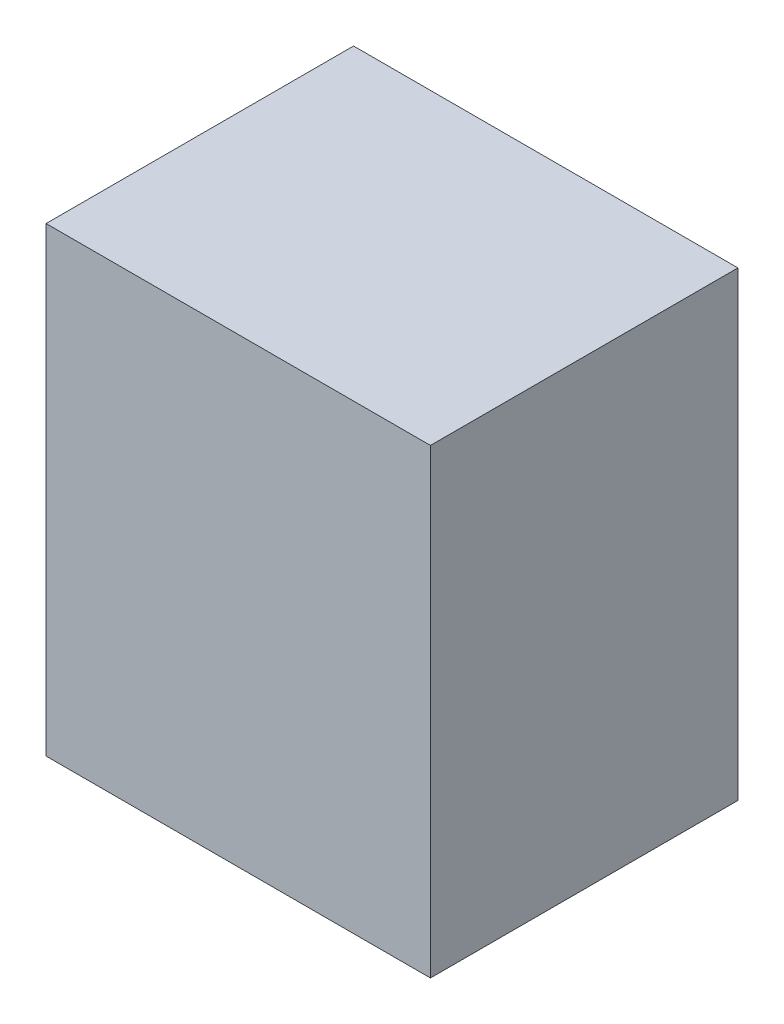
from build123d import *

# Parameters (mm, degrees)
SKETCH1_W           = 100
SKETCH1_H           = 120
BOSS_EXTRUDE1_DEPTH = 80


with BuildPart() as part:
    # Sketch1 → Boss-Extrude1 (new body)
    with BuildSketch(Plane.XY):
        with Locations((50, 60)):
            Rectangle(SKETCH1_W, SKETCH1_H)
    extrude(amount=BOSS_EXTRUDE1_DEPTH)


solid = part.part
